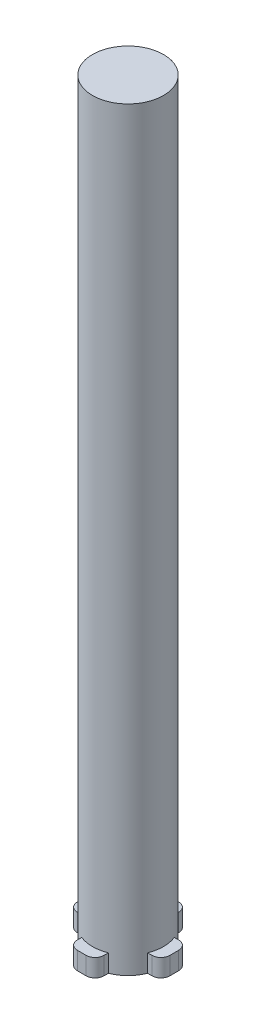
from build123d import *

# Parameters (mm, degrees)
CROQUIS1_R              = 4
SALIENTE_EXTRUIR1_DEPTH = 85
SALIENTE_EXTRUIR2_DEPTH = 2
REDONDEO1_R             = 1
MATRIZC1_COUNT          = 4
REDONDEO1_OF_MATRIZC1_R = 1


with BuildPart() as part:
    # Croquis1 → Saliente-Extruir1 (new body)
    with BuildSketch(Plane(origin=(0, 0, 0), x_dir=(1, 0, 0), z_dir=(0, 1, 0))):
        with Locations(Location((0, 0, 0), (0, 0, 270))):
            Circle(CROQUIS1_R)
    extrude(amount=SALIENTE_EXTRUIR1_DEPTH)

    # Croquis2 → Saliente-Extruir2 (add)
    with BuildSketch(Plane.XZ):
        with BuildLine():
            Line((-1.5, 5.208099244), (1.5, 5.208099244))
            Line((1.5, 5.208099244), (1.5, 3.708099244))
            ThreePointArc((1.5, 3.708099244), (0, 4), (-1.5, 3.708099244))
            Line((-1.5, 3.708099244), (-1.5, 5.208099244))
        make_face()
    saliente_extruir2 = extrude(amount=-SALIENTE_EXTRUIR2_DEPTH)

    # Redondeo1
    redondeo1_edges = [part.edges().sort_by_distance(p)[0] for p in [
        (-1.5, 1, 5.208099244),
        (1.5, 1, 5.208099244),
    ]]
    fillet(redondeo1_edges, radius=REDONDEO1_R)

    # MatrizC1: Saliente-Extruir2 ×4 about axis
    matrizc1_axis = Axis((0, 0, 0), (0, 1, 0))
    for i in range(1, MATRIZC1_COUNT):
        add(saliente_extruir2.rotate(matrizc1_axis, i * 360 / MATRIZC1_COUNT))

    # Redondeo1 of MatrizC1
    redondeo1_of_matrizc1_edges = [part.edges().sort_by_distance(p)[0] for p in [
        (5.208099244, 1, 1.5),
        (5.208099244, 1, -1.5),
        (1.5, 1, -5.208099244),
        (-1.5, 1, -5.208099244),
        (-5.208099244, 1, -1.5),
        (-5.208099244, 1, 1.5),
    ]]
    fillet(redondeo1_of_matrizc1_edges, radius=REDONDEO1_OF_MATRIZC1_R)


solid = part.part
